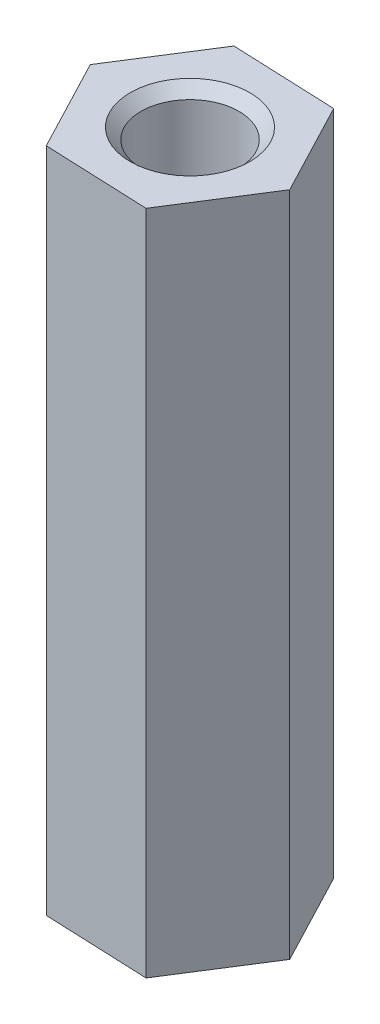
from build123d import *

# Parameters (mm, degrees)
SKETCH_1_R                   = 1.1
EXTRUDE_1_DEPTH              = 17
HOLE_WIZARD_M3_2_D           = 2.5
HOLE_WIZARD_M3_2_CSINK_D     = 3.05
HOLE_WIZARD_M3_2_CSINK_ANGLE = 90


with BuildPart() as part:
    # 草图1 → 凸台-拉伸1 (new body)
    with BuildSketch(Plane(origin=(0, 0, 0), x_dir=(1, 0, 0), z_dir=(0, 1, 0))):
        Polygon((1.231724884, -2.352910356), (2.653542583, -0.109750138), (1.421817699, 2.243160218), (-1.231724884, 2.352910356), (-2.653542583, 0.109750138), (-1.421817699, -2.243160218), align=None)
        with Locations(Location((0, 0, 0), (0, 0, 270))):
            Circle(SKETCH_1_R, mode=Mode.SUBTRACT)
    extrude(amount=EXTRUDE_1_DEPTH)

    # M3 螺纹孔2 (through all)
    with Locations(Plane(origin=(0, 17, 0), x_dir=(1, 0, 0), z_dir=(0, 1, 0))):
        with Locations((0, 0)):
            CounterSinkHole(HOLE_WIZARD_M3_2_D / 2, HOLE_WIZARD_M3_2_CSINK_D / 2, counter_sink_angle=HOLE_WIZARD_M3_2_CSINK_ANGLE)


solid = part.part
